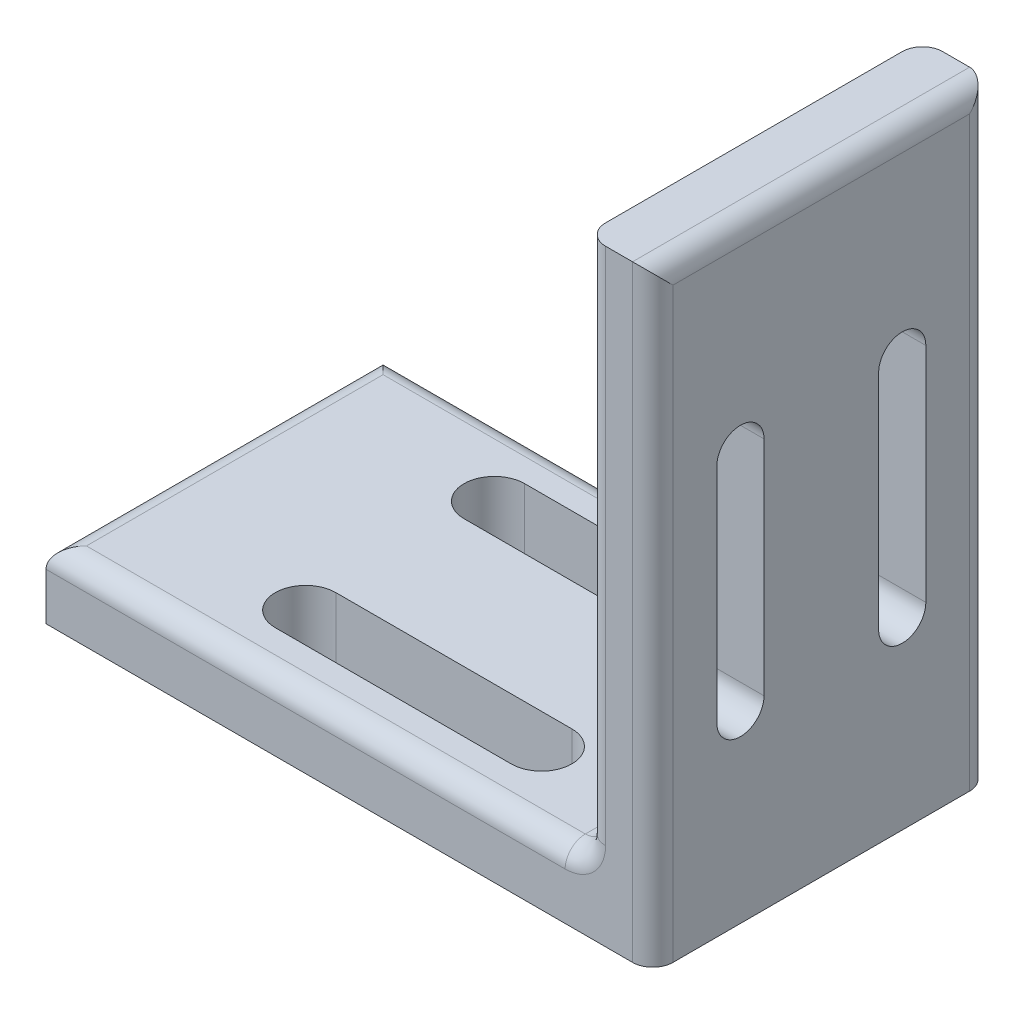
from build123d import *

# Parameters (mm, degrees)
SKETCH2_W           = 45
SKETCH2_H           = 25
BOSS_EXTRUDE1_DEPTH = 5
CUT_EXTRUDE1_DEPTH  = 27.220221204
SKETCH5_W           = 5
SKETCH5_H           = 25
BOSS_EXTRUDE2_DEPTH = 40
CUT_EXTRUDE2_DEPTH  = 62.491869381
FILLET2_R           = 1.5


with BuildPart() as part:
    # Sketch2 → Boss-Extrude1 (new body)
    with BuildSketch(Plane(origin=(0, 0, 0), x_dir=(1, 0, 0), z_dir=(0, 1, 0))):
        Rectangle(SKETCH2_W, SKETCH2_H)
    extrude(amount=BOSS_EXTRUDE1_DEPTH)

    # Sketch3 → Cut-Extrude1 (cut, through all)
    with BuildSketch(Plane(origin=(0, 5, 0), x_dir=(1, 0, 0), z_dir=(0, 1, 0))):
        with BuildLine():
            Line((-8.75, 9.25), (8.75, 9.25))
            ThreePointArc((8.75, 9.25), (11, 7), (8.75, 4.75))
            Line((8.75, 4.75), (-8.75, 4.75))
            ThreePointArc((-8.75, 4.75), (-11, 7), (-8.75, 9.25))
        make_face()
        with BuildLine():
            Line((-8.75, -4.75), (8.75, -4.75))
            ThreePointArc((8.75, -4.75), (11, -7), (8.75, -9.25))
            Line((8.75, -9.25), (-8.75, -9.25))
            ThreePointArc((-8.75, -9.25), (-11, -7), (-8.75, -4.75))
        make_face()
    extrude(amount=-CUT_EXTRUDE1_DEPTH, mode=Mode.SUBTRACT)

    # Sketch5 → Boss-Extrude2 (add)
    with BuildSketch(Plane(origin=(0, 5, 0), x_dir=(1, 0, 0), z_dir=(0, 1, 0))):
        with Locations((20, 0)):
            Rectangle(SKETCH5_W, SKETCH5_H)
    extrude(amount=BOSS_EXTRUDE2_DEPTH)

    # Sketch6 → Cut-Extrude2 (cut, through all)
    with BuildSketch(Plane.ZY.offset(-17.5)):
        with BuildLine():
            Line((-4.25, 30.25), (-4.25, 13.75))
            ThreePointArc((-4.25, 13.75), (-6, 12), (-7.75, 13.75))
            Line((-7.75, 13.75), (-7.75, 30.25))
            ThreePointArc((-7.75, 30.25), (-6, 32), (-4.25, 30.25))
        make_face()
        with BuildLine():
            Line((7.75, 30.25), (7.75, 13.75))
            ThreePointArc((7.75, 13.75), (6, 12), (4.25, 13.75))
            Line((4.25, 13.75), (4.25, 30.25))
            ThreePointArc((4.25, 30.25), (6, 32), (7.75, 30.25))
        make_face()
    extrude(amount=-CUT_EXTRUDE2_DEPTH, mode=Mode.SUBTRACT)

    # Fillet2
    fillet2_edges = [part.edges().sort_by_distance(p)[0] for p in [
        (-22.5, 5, 0),
        (-2.5, 5, 12.5),
        (-2.5, 5, -12.5),
        (17.5, 5, 0),
        (17.5, 25, -12.5),
        (17.5, 25, 12.5),
        (22.5, 45, 0),
        (22.5, 22.5, 12.5),
        (22.5, 22.5, -12.5),
    ]]
    fillet(fillet2_edges, radius=FILLET2_R)


solid = part.part
